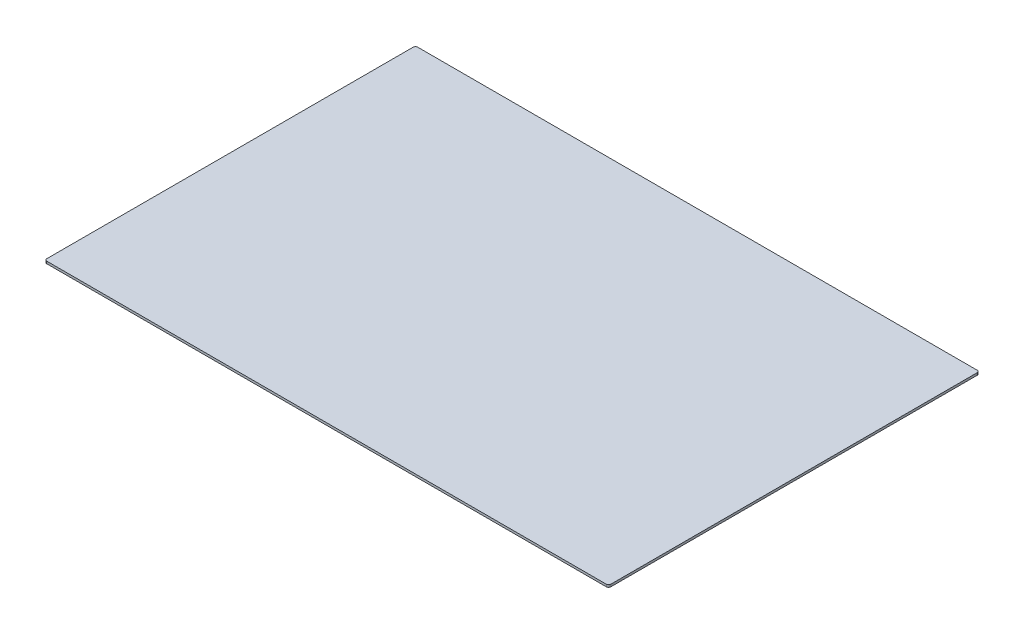
from build123d import *

# Parameters (mm, degrees)
SKETCH1_W           = 123.5
SKETCH1_H           = 81.2
BOSS_EXTRUDE1_DEPTH = 0.5
FILLET1_R           = 0.5


with BuildPart() as part:
    # Sketch1 → Boss-Extrude1 (new body)
    with BuildSketch(Plane(origin=(0, 0, 0), x_dir=(1, 0, 0), z_dir=(0, 1, 0))):
        Rectangle(SKETCH1_W, SKETCH1_H)
    extrude(amount=BOSS_EXTRUDE1_DEPTH)

    # Fillet1
    fillet1_edges = [part.edges().sort_by_distance(p)[0] for p in [
        (61.75, 0.25, 40.6),
        (-61.75, 0.25, 40.6),
        (-61.75, 0.25, -40.6),
        (61.75, 0.25, -40.6),
    ]]
    fillet(fillet1_edges, radius=FILLET1_R)


solid = part.part
